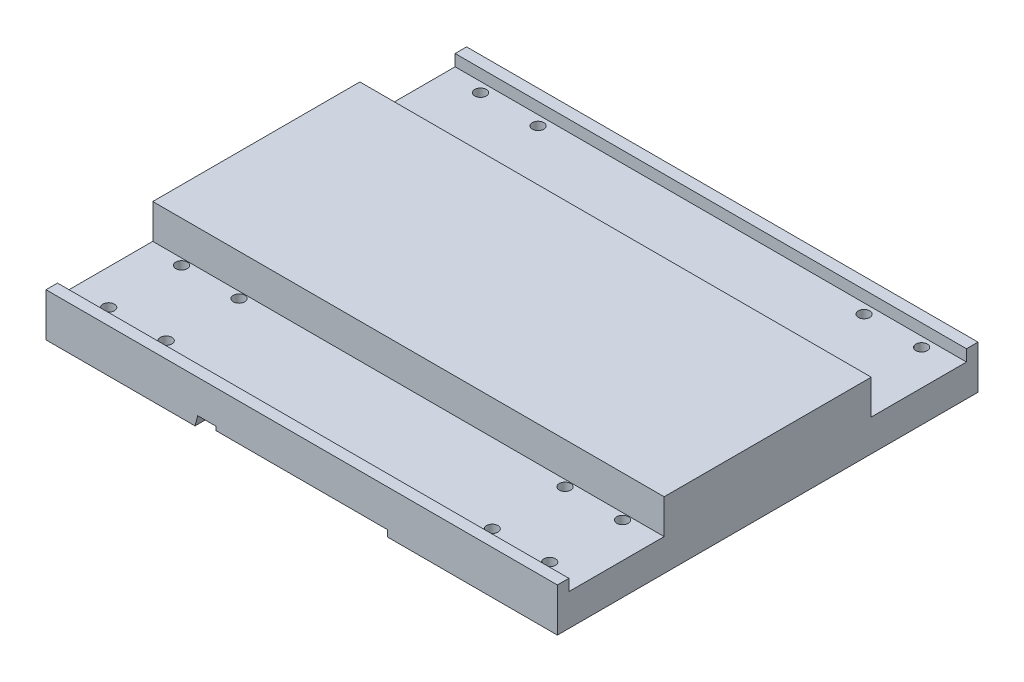
from build123d import *

# Parameters (mm, degrees)
SKETCH_1_W          = 400
SKETCH_1_H          = 329
EXTRUDE_2_DEPTH     = 25
SKETCH_2_W          = 400
SKETCH_2_H          = 9
EXTRUDE_3_DEPTH     = 9
SKETCH_3_W          = 81
SKETCH_3_H          = 27
EXTRUDE_4_DEPTH     = 400
SKETCH_4_W          = 67.25
SKETCH_4_H          = 5
CUT_EXTRUDE_1_DEPTH = 5
CUT_EXTRUDE_2_DEPTH = 400
CUT_EXTRUDE_3_DEPTH = 400
SKETCH_8_R          = 4.5
CUT_EXTRUDE_4_DEPTH = 400


with BuildPart() as part:
    # 草图1 → 凸台-拉伸2 (new body)
    with BuildSketch(Plane(origin=(0, 0, 0), x_dir=(1, 0, 0), z_dir=(0, 1, 0))):
        with Locations((200, 164.5)):
            Rectangle(SKETCH_1_W, SKETCH_1_H)
    extrude(amount=EXTRUDE_2_DEPTH)

    # 草图2 → 凸台-拉伸3 (add)
    with BuildSketch(Plane(origin=(0, 25, 0), x_dir=(1, 0, 0), z_dir=(0, 1, 0))):
        with Locations((200, 324.5)):
            Rectangle(SKETCH_2_W, SKETCH_2_H)
        with Locations((200, 4.5)):
            Rectangle(SKETCH_2_W, SKETCH_2_H)
    extrude(amount=EXTRUDE_3_DEPTH)

    # 草图3 → 凸台-拉伸4 (add)
    with BuildSketch(Plane(origin=(400, 0, 0), x_dir=(0, 0, -1), z_dir=(1, 0, 0))):
        with Locations((205, 38.5)):
            Rectangle(SKETCH_3_W, SKETCH_3_H)
        with Locations((124, 38.5)):
            Rectangle(SKETCH_3_W, SKETCH_3_H)
    extrude(amount=-EXTRUDE_4_DEPTH)

    # 草图4 → 切除-拉伸1 (cut)
    with BuildSketch(Plane.XZ):
        Polygon((200, -5), (200, 0), (133, 0), (133, -329), (267.25, -329), (267.25, -5), align=None)
        with Locations((233.625, -2.5)):
            Rectangle(SKETCH_4_W, SKETCH_4_H)
    extrude(amount=-CUT_EXTRUDE_1_DEPTH, mode=Mode.SUBTRACT)

    # 草图5 → 切除-拉伸2 (cut)
    with BuildSketch(Plane.XY):
        Polygon((133, 5), (133, 8), (118.7, 8), (118.7, 0), (133, 0), align=None)
    extrude(amount=-CUT_EXTRUDE_2_DEPTH, mode=Mode.SUBTRACT)

    # 草图6 → 切除-拉伸3 (cut)
    with BuildSketch(Plane.XY):
        Polygon((118.7, 8), (116.556406461, 0), (118.7, 0), align=None)
    extrude(amount=-CUT_EXTRUDE_3_DEPTH, mode=Mode.SUBTRACT)

    # 草图8 → 切除-拉伸4 (cut)
    with BuildSketch(Plane.XZ):
        with Locations(Location((372.5, -312.4, 0), (0, 0, 270))):
            Circle(SKETCH_8_R)
        with Locations(Location((327.5, -312.4, 0), (0, 0, 270))):
            Circle(SKETCH_8_R)
        with Locations(Location((372.5, -255.4, 0), (0, 0, 270))):
            Circle(SKETCH_8_R)
        with Locations(Location((327.5, -255.4, 0), (0, 0, 270))):
            Circle(SKETCH_8_R)
        with Locations(Location((372.5, -78.5, 0), (0, 0, 270))):
            Circle(SKETCH_8_R)
        with Locations(Location((327.5, -78.5, 0), (0, 0, 270))):
            Circle(SKETCH_8_R)
        with Locations(Location((372.5, -21.5, 0), (0, 0, 270))):
            Circle(SKETCH_8_R)
        with Locations(Location((327.5, -21.5, 0), (0, 0, 270))):
            Circle(SKETCH_8_R)
        with Locations(Location((27.5, -21.5, 0), (0, 0, 270))):
            Circle(SKETCH_8_R)
        with Locations(Location((72.5, -21.5, 0), (0, 0, 270))):
            Circle(SKETCH_8_R)
        with Locations(Location((72.5, -78.5, 0), (0, 0, 270))):
            Circle(SKETCH_8_R)
        with Locations(Location((27.5, -78.5, 0), (0, 0, 270))):
            Circle(SKETCH_8_R)
        with Locations(Location((72.5, -312.4, 0), (0, 0, 270))):
            Circle(SKETCH_8_R)
        with Locations(Location((27.5, -312.4, 0), (0, 0, 270))):
            Circle(SKETCH_8_R)
        with Locations(Location((27.5, -255.4, 0), (0, 0, 270))):
            Circle(SKETCH_8_R)
        with Locations(Location((72.5, -255.4, 0), (0, 0, 270))):
            Circle(SKETCH_8_R)
    extrude(amount=-CUT_EXTRUDE_4_DEPTH, mode=Mode.SUBTRACT)


solid = part.part
